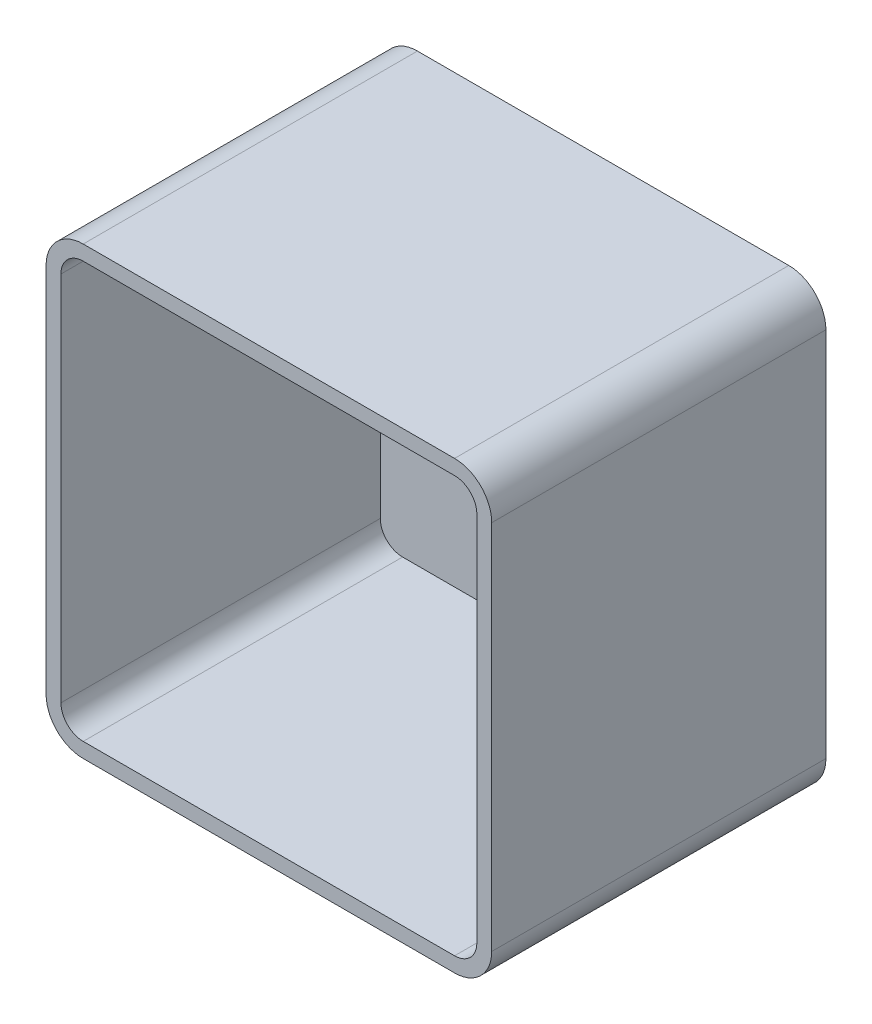
from build123d import *

# Parameters (mm, degrees)
SKETCH1_W           = 120
SKETCH1_H           = 120
BOSS_EXTRUDE1_DEPTH = 90
FILLET1_R           = 10
SHELL1_T            = -4


with BuildPart() as part:
    # Sketch1 → Boss-Extrude1 (new body)
    with BuildSketch(Plane.XY):
        with Locations((20.096223412, -34.028145411)):
            Rectangle(SKETCH1_W, SKETCH1_H)
    extrude(amount=BOSS_EXTRUDE1_DEPTH)

    # Fillet1
    fillet1_edges = [part.edges().sort_by_distance(p)[0] for p in [
        (-39.903776588, 25.971854589, 45),
        (80.096223412, 25.971854589, 45),
        (80.096223412, -94.028145411, 45),
        (-39.903776588, -94.028145411, 45),
    ]]
    fillet(fillet1_edges, radius=FILLET1_R)

    # Shell1
    shell1_openings = [part.faces().sort_by_distance(p)[0] for p in [
        (20.096223412, -34.028145411, 90),
    ]]
    offset(amount=SHELL1_T, openings=shell1_openings, kind=Kind.INTERSECTION)


solid = part.part
